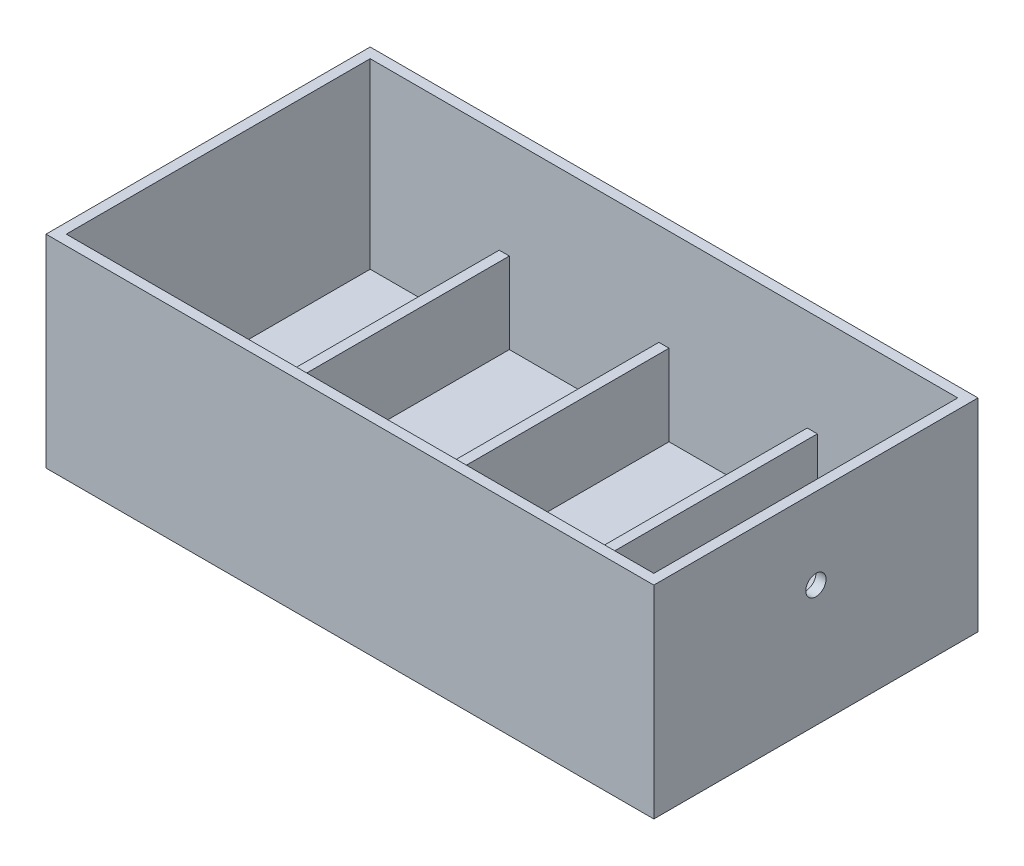
from build123d import *

# Parameters (mm, degrees)
SKETCH1_W           = 150
SKETCH1_H           = 80
BOSS_EXTRUDE1_DEPTH = 50
SKETCH2_W           = 145
SKETCH2_H           = 75
CUT_EXTRUDE1_DEPTH  = 45
SKETCH6_W           = 2.5
SKETCH6_H           = 75
BOSS_EXTRUDE3_DEPTH = 20
SKETCH7_W           = 2.5
SKETCH7_H           = 75
BOSS_EXTRUDE4_DEPTH = 20
SKETCH10_W          = 2.5
SKETCH10_H          = 75
BOSS_EXTRUDE5_DEPTH = 20
SKETCH12_R          = 2.5
CUT_EXTRUDE8_DEPTH  = 10


with BuildPart() as part:
    # Sketch1 → Boss-Extrude1 (new body)
    with BuildSketch(Plane(origin=(0, 0, 0), x_dir=(1, 0, 0), z_dir=(0, 1, 0))):
        Rectangle(SKETCH1_W, SKETCH1_H)
    extrude(amount=BOSS_EXTRUDE1_DEPTH)

    # Sketch2 → Cut-Extrude1 (cut)
    with BuildSketch(Plane(origin=(0, 50, 0), x_dir=(1, 0, 0), z_dir=(0, 1, 0))):
        Rectangle(SKETCH2_W, SKETCH2_H)
    extrude(amount=-CUT_EXTRUDE1_DEPTH, mode=Mode.SUBTRACT)

    # Sketch6 → Boss-Extrude3 (add)
    with BuildSketch(Plane(origin=(0, 5, 0), x_dir=(1, 0, 0), z_dir=(0, 1, 0))):
        Rectangle(SKETCH6_W, SKETCH6_H)
    extrude(amount=BOSS_EXTRUDE3_DEPTH)

    # Sketch7 → Boss-Extrude4 (add)
    with BuildSketch(Plane(origin=(0, 5, 0), x_dir=(1, 0, 0), z_dir=(0, 1, 0))):
        with Locations((-39.404677113, 0)):
            Rectangle(SKETCH7_W, SKETCH7_H)
    extrude(amount=BOSS_EXTRUDE4_DEPTH)

    # Sketch10 → Boss-Extrude5 (add)
    with BuildSketch(Plane(origin=(0, 5, 0), x_dir=(1, 0, 0), z_dir=(0, 1, 0))):
        with Locations((36.606323204, 0)):
            Rectangle(SKETCH10_W, SKETCH10_H)
    extrude(amount=BOSS_EXTRUDE5_DEPTH)

    # Sketch12 → Cut-Extrude8 (cut)
    with BuildSketch(Plane(origin=(75, 0, 0), x_dir=(0, 0, -1), z_dir=(1, 0, 0))):
        with Locations((0, 30)):
            Circle(SKETCH12_R)
    extrude(amount=-CUT_EXTRUDE8_DEPTH, mode=Mode.SUBTRACT)


solid = part.part
